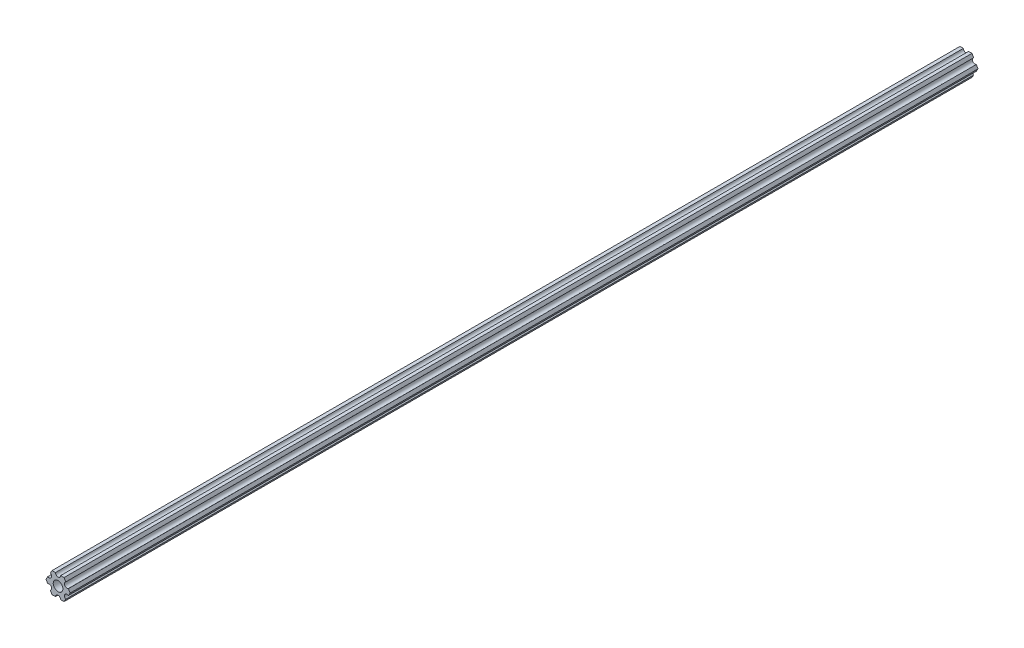
from build123d import *

# Parameters (mm, degrees)
SKETCH1_R           = 2.9337
BOSS_EXTRUDE1_DEPTH = 552.45


with BuildPart() as part:
    # Sketch1 → Boss-Extrude1 (new body)
    with BuildSketch(Plane(origin=(0, 0, 0), x_dir=(-1, 0, 0), z_dir=(0, 0, -1))):
        with BuildLine():
            Line((-4.70551159, -4.549815043), (-3.666174521, -6.349999904))
            Line((-3.666174521, -6.349999904), (-1.587500385, -6.349999904))
            ThreePointArc((-1.587500385, -6.349999904), (-3.85e-07, -4.762499904), (1.587499615, -6.349999904))
            Line((1.587499615, -6.349999904), (3.666173825, -6.349999904))
            Line((3.666173825, -6.349999904), (4.705510942, -4.54981524))
            ThreePointArc((4.705510942, -4.54981524), (4.124445629, -2.381249907), (6.293010962, -1.800184594))
            Line((6.293010962, -1.800184594), (7.332348079, 7e-08))
            Line((7.332348079, 7e-08), (6.293011217, 1.800184685))
            ThreePointArc((6.293011217, 1.800184685), (4.124445939, 2.381250203), (4.705511457, 4.549815481))
            Line((4.705511457, 4.549815481), (3.666174521, 6.350000222))
            Line((3.666174521, 6.350000222), (1.587500385, 6.350000222))
            ThreePointArc((1.587500385, 6.350000222), (3.85e-07, 4.762500222), (-1.587499615, 6.350000222))
            Line((-1.587499615, 6.350000222), (-3.666173825, 6.350000222))
            Line((-3.666173825, 6.350000222), (-4.705511038, 4.549815614))
            ThreePointArc((-4.705511038, 4.549815614), (-4.124445841, 2.38125025), (-6.293011205, 1.800185053))
            Line((-6.293011205, 1.800185053), (-7.332348419, 4.44e-07))
            Line((-7.332348419, 4.44e-07), (-6.293011423, -1.80018429))
            ThreePointArc((-6.293011423, -1.80018429), (-4.12444613, -2.38124975), (-4.70551159, -4.549815043))
        make_face()
        with Locations(Location((0, 0, 0), (0, 0, 180))):
            Circle(SKETCH1_R, mode=Mode.SUBTRACT)
    extrude(amount=-BOSS_EXTRUDE1_DEPTH)


solid = part.part
